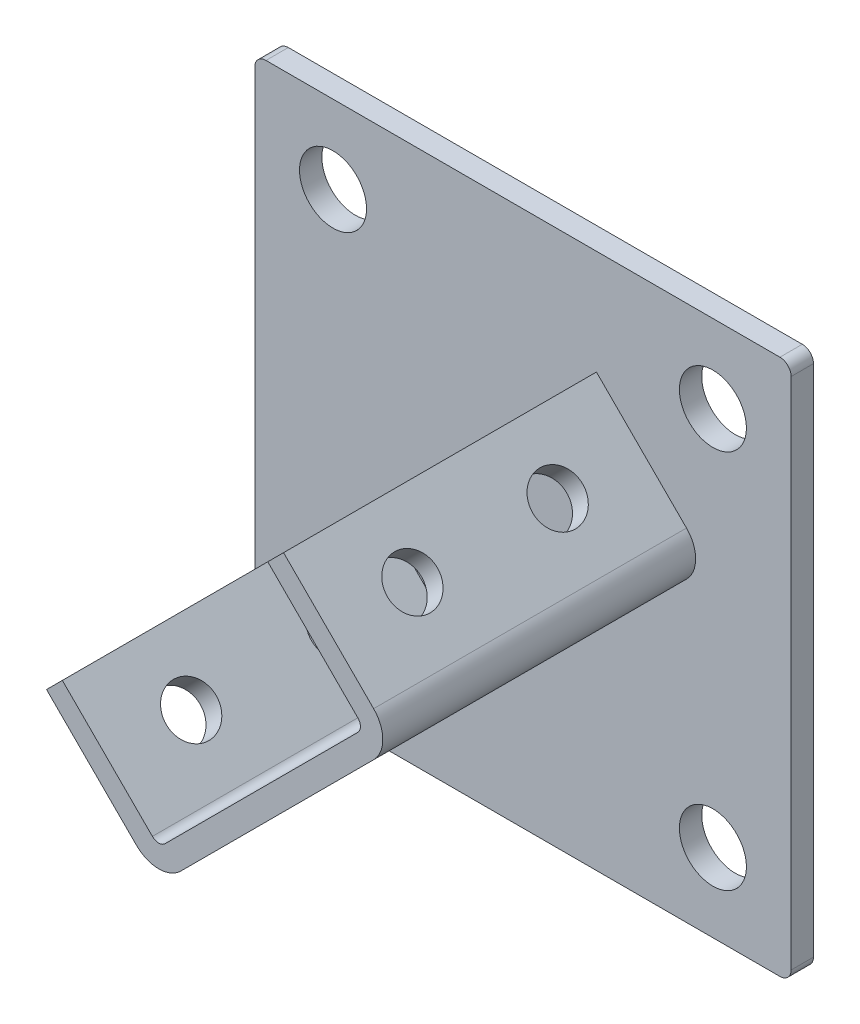
from build123d import *

# Parameters (mm, degrees)
SKETCH1_R           = 9.525
BOSS_EXTRUDE1_DEPTH = 6.35
EXTRUDE_THIN1_DEPTH = 88.9
SKETCH3_R           = 7.112
CUT_EXTRUDE1_DEPTH  = 144.824345992
CIRPATTERN1_COUNT   = 4


with BuildPart() as part:
    # Sketch1 → Boss-Extrude1 (new body)
    with BuildSketch(Plane.XY):
        with BuildLine():
            Line((-73.025, 76.2), (73.025, 76.2))
            ThreePointArc((73.025, 76.2), (75.27006403, 75.27006403), (76.2, 73.025))
            Line((76.2, 73.025), (76.2, -73.025))
            ThreePointArc((76.2, -73.025), (75.27006403, -75.27006403), (73.025, -76.2))
            Line((73.025, -76.2), (-73.025, -76.2))
            ThreePointArc((-73.025, -76.2), (-75.27006403, -75.27006403), (-76.2, -73.025))
            Line((-76.2, -73.025), (-76.2, 73.025))
            ThreePointArc((-76.2, 73.025), (-75.27006403, 75.27006403), (-73.025, 76.2))
        make_face()
        with Locations((-53.975, 53.975)):
            Circle(SKETCH1_R, mode=Mode.SUBTRACT)
        with Locations((-53.975, -53.975)):
            Circle(SKETCH1_R, mode=Mode.SUBTRACT)
        with Locations((53.975, 53.975)):
            Circle(SKETCH1_R, mode=Mode.SUBTRACT)
        with Locations((53.975, -53.975)):
            Circle(SKETCH1_R, mode=Mode.SUBTRACT)
    extrude(amount=BOSS_EXTRUDE1_DEPTH)

    # Sketch2 → Extrude-Thin1 (add)
    with BuildSketch(Plane.XY.offset(6.35)):
        with BuildLine():
            Line((-41.982697366, -16.388967421), (-16.388967421, -41.982697366))
            ThreePointArc((-16.388967421, -41.982697366), (-14.592916197, -42.726646142), (-12.796864973, -41.982697366))
            Line((-12.796864973, -41.982697366), (41.982697366, 12.796864973))
            ThreePointArc((41.982697366, 12.796864973), (42.726646142, 14.592916197), (41.982697366, 16.388967421))
            Line((41.982697366, 16.388967421), (16.388967421, 41.982697366))
            Line((16.388967421, 41.982697366), (20.879095481, 46.472825427))
            Line((20.879095481, 46.472825427), (46.472825427, 20.879095481))
            ThreePointArc((46.472825427, 20.879095481), (49.076646142, 14.592916197), (46.472825427, 8.306736912))
            Line((46.472825427, 8.306736912), (-8.306736912, -46.472825427))
            ThreePointArc((-8.306736912, -46.472825427), (-14.592916197, -49.076646142), (-20.879095481, -46.472825427))
            Line((-20.879095481, -46.472825427), (-46.472825427, -20.879095481))
            Line((-46.472825427, -20.879095481), (-41.982697366, -16.388967421))
        make_face()
    extrude(amount=EXTRUDE_THIN1_DEPTH)

    # Sketch3 → Cut-Extrude1 (cut, through all)
    with BuildSketch(Plane(origin=(0, 0, 0), x_dir=(-0.7071067811865511, -0.707106781186544, 0), z_dir=(0.707106781186544, -0.7071067811865511, 0))):
        with Locations((-20.6375, -30.1625)):
            Circle(SKETCH3_R)
        with Locations((-20.6375, -71.4375)):
            Circle(SKETCH3_R)
        with Locations((20.6375, -71.4375)):
            Circle(SKETCH3_R)
        with Locations((20.6375, -30.1625)):
            Circle(SKETCH3_R)
    cut_extrude1 = extrude(amount=CUT_EXTRUDE1_DEPTH, mode=Mode.SUBTRACT)

    # CirPattern1: Cut-Extrude1 ×4 about axis, 1 skipped
    cirpattern1_axis = Axis((14.592916197, 14.592916197, 71.4375), (0, 0, -1))
    add([cut_extrude1.rotate(cirpattern1_axis, i * 360 / CIRPATTERN1_COUNT) for i in range(1, CIRPATTERN1_COUNT) if i not in (2,)], mode=Mode.SUBTRACT)


solid = part.part
